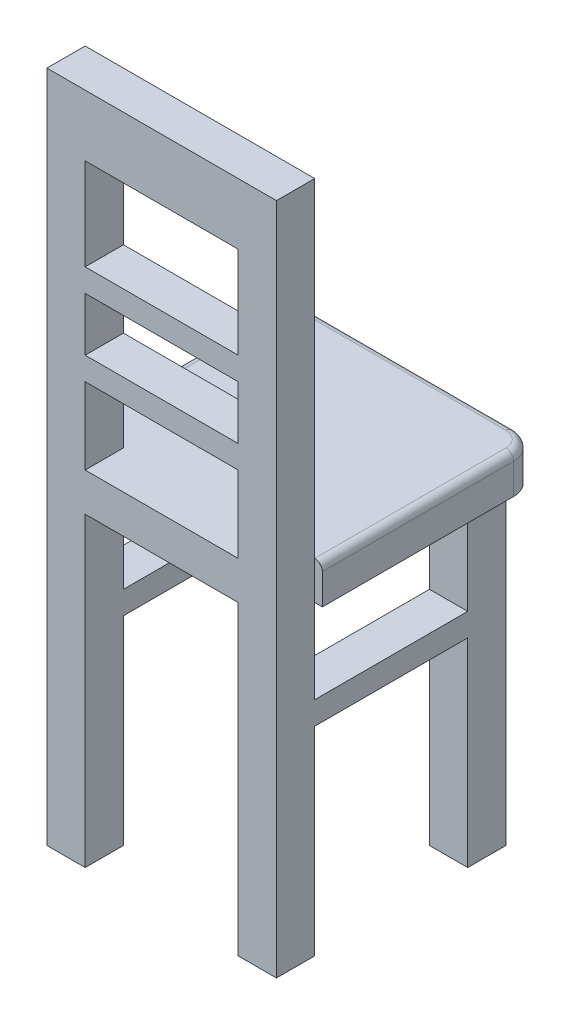
from build123d import *

# Parameters (mm, degrees)
SKETCH1_W             = 5
SKETCH1_H             = 5
BOSS_EXTRUDE1_DEPTH   = 40
BOSS_EXTRUDE1_2_DEPTH = 40
BOSS_EXTRUDE1_3_DEPTH = 40
BOSS_EXTRUDE1_4_DEPTH = 40
BOSS_EXTRUDE2_DEPTH   = 5
SKETCH3_W             = 5
SKETCH3_H             = 5
BOSS_EXTRUDE3_DEPTH   = 40
SKETCH4_W             = 30
SKETCH4_H             = 5
BOSS_EXTRUDE4_DEPTH   = 8
SKETCH5_W             = 5
SKETCH5_H             = 3
BOSS_EXTRUDE5_DEPTH   = 20
SKETCH6_W             = 5
SKETCH6_H             = 3
BOSS_EXTRUDE6_DEPTH   = 20
FILLET1_R             = 3
FILLET2_R             = 1


with BuildPart() as part:
    # Sketch1 → Boss-Extrude1 (new body)
    with BuildSketch(Plane(origin=(0, 0, 0), x_dir=(1, 0, 0), z_dir=(0, 1, 0))):
        with Locations((-27.5, 2.5)):
            Rectangle(SKETCH1_W, SKETCH1_H)
    extrude(amount=BOSS_EXTRUDE1_DEPTH)



with BuildPart() as body_2:
    # Sketch1 → Boss-Extrude1 2 (new body)
    with BuildSketch(Plane(origin=(0, 0, 0), x_dir=(1, 0, 0), z_dir=(0, 1, 0))):
        with Locations((-2.5, 2.5)):
            Rectangle(SKETCH1_W, SKETCH1_H)
    extrude(amount=BOSS_EXTRUDE1_2_DEPTH)


with BuildPart() as body_3:
    # Sketch1 → Boss-Extrude1 3 (new body)
    with BuildSketch(Plane(origin=(0, 0, 0), x_dir=(1, 0, 0), z_dir=(0, 1, 0))):
        with Locations((-2.5, 27.5)):
            Rectangle(SKETCH1_W, SKETCH1_H)
    extrude(amount=BOSS_EXTRUDE1_3_DEPTH)



with BuildPart() as body_4:
    # Sketch1 → Boss-Extrude1 4 (new body)
    with BuildSketch(Plane(origin=(0, 0, 0), x_dir=(1, 0, 0), z_dir=(0, 1, 0))):
        with Locations((-27.5, 27.5)):
            Rectangle(SKETCH1_W, SKETCH1_H)
    extrude(amount=BOSS_EXTRUDE1_4_DEPTH)


with BuildPart() as body_3_1:
    add(body_3.part)

    add(body_4.part)  # Boss-Extrude2 merges body 4
    # Sketch2 → Boss-Extrude2 (add)
    with BuildSketch(Plane(origin=(0, 40, 0), x_dir=(1, 0, 0), z_dir=(0, 1, 0))):
        Polygon((-5, 0), (-5, 5), (1, 5), (1, 33), (-31, 33), (-31, 5), (-30, 5), (-25, 5), (-25, 0), align=None)
    extrude(amount=BOSS_EXTRUDE2_DEPTH)


with BuildPart() as part_1:
    add(part.part)

    add(body_2.part)  # Boss-Extrude3 merges body 2

    add(body_3_1.part)  # Boss-Extrude3 merges body 3
    # Sketch3 → Boss-Extrude3 (add)
    with BuildSketch(Plane(origin=(0, 40, 0), x_dir=(1, 0, 0), z_dir=(0, 1, 0))):
        with Locations((-27.5, 2.5)):
            Rectangle(SKETCH3_W, SKETCH3_H)
        with Locations((-2.5, 2.5)):
            Rectangle(SKETCH3_W, SKETCH3_H)
    extrude(amount=BOSS_EXTRUDE3_DEPTH)

    # Sketch4 → Boss-Extrude4 (add)
    with BuildSketch(Plane(origin=(0, 80, 0), x_dir=(1, 0, 0), z_dir=(0, 1, 0))):
        with Locations((-15, 2.5)):
            Rectangle(SKETCH4_W, SKETCH4_H)
    extrude(amount=BOSS_EXTRUDE4_DEPTH)

    # Sketch5 → Boss-Extrude5 (add)
    with BuildSketch(Plane(origin=(-25, 0, 0), x_dir=(0, 0, -1), z_dir=(1, 0, 0))):
        with Locations((2.5, 66.5)):
            Rectangle(SKETCH5_W, SKETCH5_H)
        with Locations((2.5, 56.5)):
            Rectangle(SKETCH5_W, SKETCH5_H)
    extrude(amount=BOSS_EXTRUDE5_DEPTH)

    # Sketch6 → Boss-Extrude6 (add)
    with BuildSketch(Plane(origin=(0, 0, -5), x_dir=(-1, 0, 0), z_dir=(0, 0, -1))):
        with Locations((2.5, 27.5)):
            Rectangle(SKETCH6_W, SKETCH6_H)
        with Locations((27.5, 27.5)):
            Rectangle(SKETCH6_W, SKETCH6_H)
    extrude(amount=BOSS_EXTRUDE6_DEPTH)

    # Fillet1
    fillet1_edges = [part_1.edges().sort_by_distance(p)[0] for p in [
        (1, 42.5, -33),
        (-31, 42.5, -33),
    ]]
    fillet(fillet1_edges, radius=FILLET1_R)

    # Fillet2
    fillet2_edges = [part_1.edges().sort_by_distance(p)[0] for p in [
        (-31, 45, -17.5),
        (-30.121320344, 45, -32.121320344),
        (-15, 45, -33),
        (0.121320344, 45, -32.121320344),
        (1, 45, -17.5),
    ]]
    fillet(fillet2_edges, radius=FILLET2_R)


solid = part_1.part
